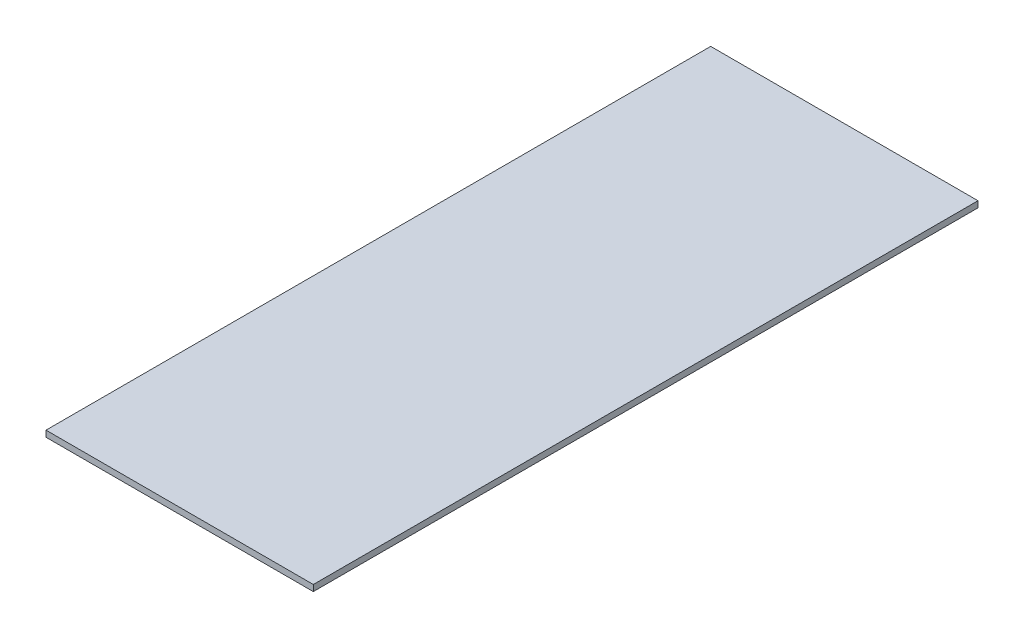
from build123d import *

# Parameters (mm, degrees)
SKETCH1_W           = 241.3
SKETCH1_H           = 600
BOSS_EXTRUDE1_DEPTH = 5.588


with BuildPart() as part:
    # Sketch1 → Boss-Extrude1 (new body)
    with BuildSketch(Plane(origin=(0, 0, 0), x_dir=(1, 0, 0), z_dir=(0, 1, 0))):
        Rectangle(SKETCH1_W, SKETCH1_H)
    extrude(amount=BOSS_EXTRUDE1_DEPTH)


solid = part.part
